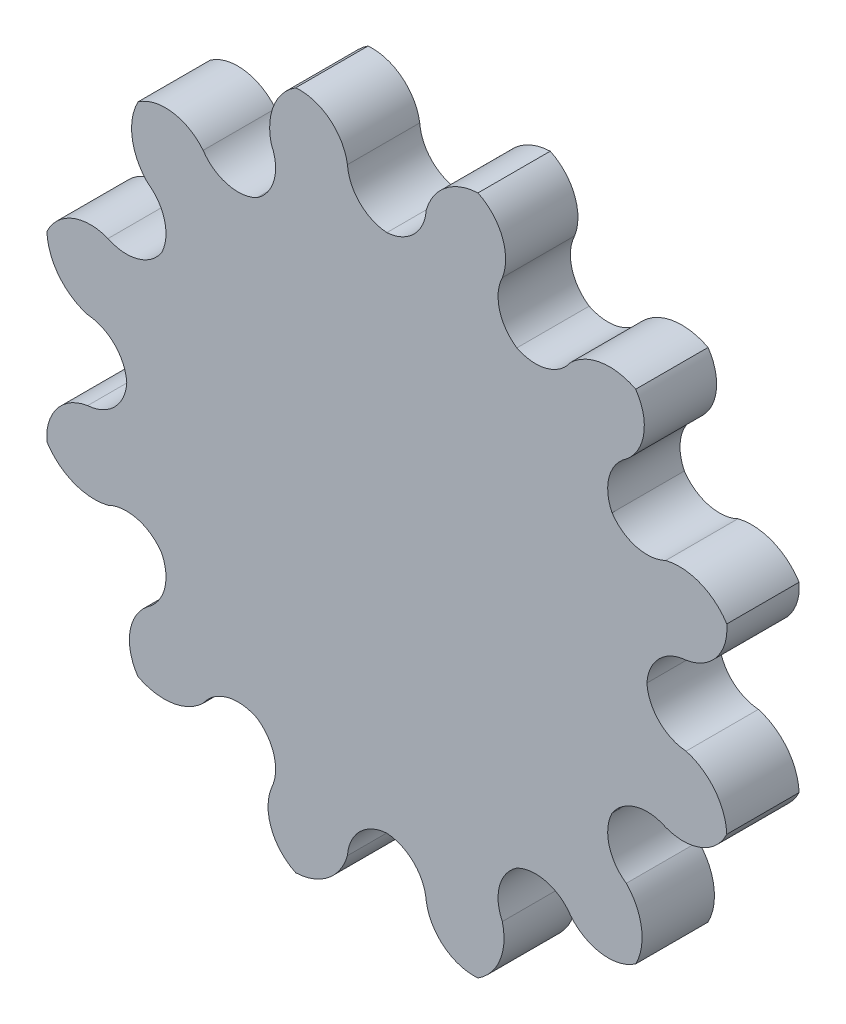
from build123d import *

# Parameters (mm, degrees)
BOSS_EXTRUDE4_DEPTH = 6


with BuildPart() as part:
    # Sketch4 → Boss-Extrude4 (new body)
    with BuildSketch(Plane.XY):
        with BuildLine():
            ThreePointArc((0, 21.573833609), (2.244076515, 22.584556995), (3.267964856, 24.822657492))
            ThreePointArc((3.267964856, 24.822657492), (4.865501824, 27.205902748), (7.556485251, 28.201186884))
            ThreePointArc((7.556485251, 28.201186884), (9.568303086, 26.065235227), (9.581188162, 23.131034405))
            ThreePointArc((9.581188162, 23.131034405), (9.348851227, 20.680838348), (10.786916804, 18.683487962))
            ThreePointArc((10.786916804, 18.683487962), (13.235705768, 18.436761833), (15.24146933, 19.86306955))
            ThreePointArc((15.24146933, 19.86306955), (17.816599556, 21.128252), (20.644701633, 20.644701633))
            ThreePointArc((20.644701633, 20.644701633), (21.319011157, 17.789004319), (19.86306955, 15.24146933))
            ThreePointArc((19.86306955, 15.24146933), (18.436761833, 13.235705768), (18.683487962, 10.786916804))
            ThreePointArc((18.683487962, 10.786916804), (20.680838348, 9.348851227), (23.131034405, 9.581188162))
            ThreePointArc((23.131034405, 9.581188162), (25.993753825, 9.389303192), (28.201186884, 7.556485251))
            ThreePointArc((28.201186884, 7.556485251), (27.357307405, 4.74622407), (24.822657492, 3.267964856))
            ThreePointArc((24.822657492, 3.267964856), (22.584556995, 2.244076515), (21.573833609, 0))
            ThreePointArc((21.573833609, 0), (22.584556995, -2.244076515), (24.822657492, -3.267964856))
            ThreePointArc((24.822657492, -3.267964856), (27.205902748, -4.865501824), (28.201186884, -7.556485251))
            ThreePointArc((28.201186884, -7.556485251), (26.065235227, -9.568303086), (23.131034405, -9.581188162))
            ThreePointArc((23.131034405, -9.581188162), (20.680838348, -9.348851227), (18.683487962, -10.786916804))
            ThreePointArc((18.683487962, -10.786916804), (18.436761833, -13.235705768), (19.86306955, -15.24146933))
            ThreePointArc((19.86306955, -15.24146933), (21.128252, -17.816599556), (20.644701633, -20.644701633))
            ThreePointArc((20.644701633, -20.644701633), (17.789004319, -21.319011157), (15.24146933, -19.86306955))
            ThreePointArc((15.24146933, -19.86306955), (13.235705768, -18.436761833), (10.786916804, -18.683487962))
            ThreePointArc((10.786916804, -18.683487962), (9.348851227, -20.680838348), (9.581188162, -23.131034405))
            ThreePointArc((9.581188162, -23.131034405), (9.389303192, -25.993753825), (7.556485251, -28.201186884))
            ThreePointArc((7.556485251, -28.201186884), (4.74622407, -27.357307405), (3.267964856, -24.822657492))
            ThreePointArc((3.267964856, -24.822657492), (2.244076515, -22.584556995), (0, -21.573833609))
            ThreePointArc((0, -21.573833609), (-2.244076515, -22.584556995), (-3.267964856, -24.822657492))
            ThreePointArc((-3.267964856, -24.822657492), (-4.865501824, -27.205902748), (-7.556485251, -28.201186884))
            ThreePointArc((-7.556485251, -28.201186884), (-9.568303086, -26.065235227), (-9.581188162, -23.131034405))
            ThreePointArc((-9.581188162, -23.131034405), (-9.348851227, -20.680838348), (-10.786916804, -18.683487962))
            ThreePointArc((-10.786916804, -18.683487962), (-13.235705768, -18.436761833), (-15.24146933, -19.86306955))
            ThreePointArc((-15.24146933, -19.86306955), (-17.816599556, -21.128252), (-20.644701633, -20.644701633))
            ThreePointArc((-20.644701633, -20.644701633), (-21.319011157, -17.789004319), (-19.86306955, -15.24146933))
            ThreePointArc((-19.86306955, -15.24146933), (-18.436761833, -13.235705768), (-18.683487962, -10.786916804))
            ThreePointArc((-18.683487962, -10.786916804), (-20.680838348, -9.348851227), (-23.131034405, -9.581188162))
            ThreePointArc((-23.131034405, -9.581188162), (-25.993753825, -9.389303192), (-28.201186884, -7.556485251))
            ThreePointArc((-28.201186884, -7.556485251), (-27.357307405, -4.74622407), (-24.822657492, -3.267964856))
            ThreePointArc((-24.822657492, -3.267964856), (-22.584556995, -2.244076515), (-21.573833609, 0))
            ThreePointArc((-21.573833609, 0), (-22.584556995, 2.244076515), (-24.822657492, 3.267964856))
            ThreePointArc((-24.822657492, 3.267964856), (-27.205902748, 4.865501824), (-28.201186884, 7.556485251))
            ThreePointArc((-28.201186884, 7.556485251), (-26.065235227, 9.568303086), (-23.131034405, 9.581188162))
            ThreePointArc((-23.131034405, 9.581188162), (-20.680838348, 9.348851227), (-18.683487962, 10.786916804))
            ThreePointArc((-18.683487962, 10.786916804), (-18.436761833, 13.235705768), (-19.86306955, 15.24146933))
            ThreePointArc((-19.86306955, 15.24146933), (-21.128252, 17.816599556), (-20.644701633, 20.644701633))
            ThreePointArc((-20.644701633, 20.644701633), (-17.789004319, 21.319011157), (-15.24146933, 19.86306955))
            ThreePointArc((-15.24146933, 19.86306955), (-13.235705768, 18.436761833), (-10.786916804, 18.683487962))
            ThreePointArc((-10.786916804, 18.683487962), (-9.348851227, 20.680838348), (-9.581188162, 23.131034405))
            ThreePointArc((-9.581188162, 23.131034405), (-9.389303192, 25.993753825), (-7.556485251, 28.201186884))
            ThreePointArc((-7.556485251, 28.201186884), (-4.74622407, 27.357307405), (-3.267964856, 24.822657492))
            ThreePointArc((-3.267964856, 24.822657492), (-2.244076515, 22.584556995), (0, 21.573833609))
        make_face()
    extrude(amount=BOSS_EXTRUDE4_DEPTH)


solid = part.part
